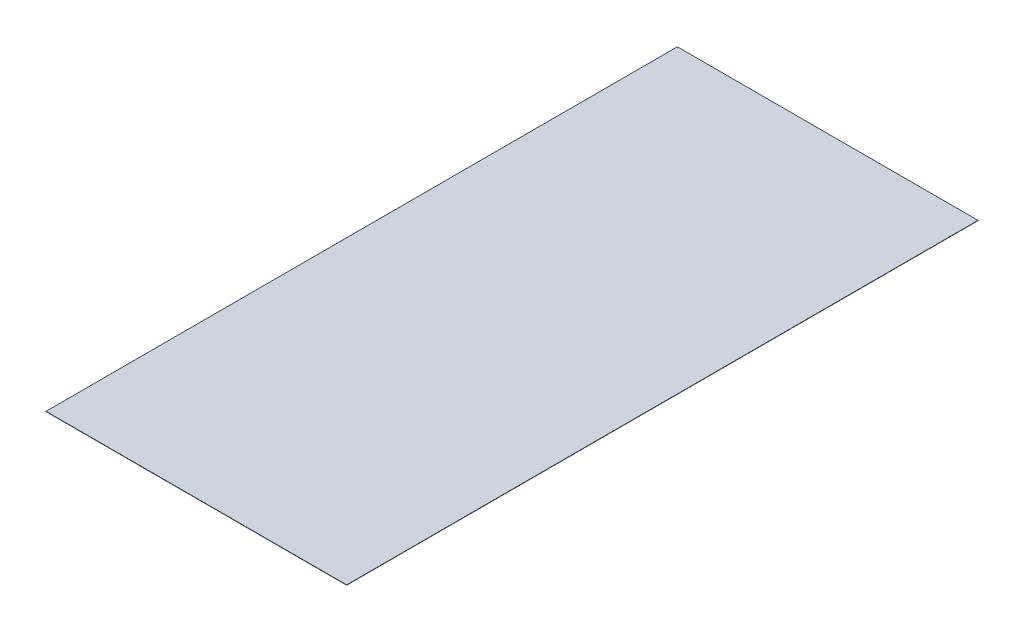
from build123d import *

# Parameters (mm, degrees)
SKETCH_1_W      = 1000
SKETCH_1_H      = 2100
EXTRUDE_1_DEPTH = 1


with BuildPart() as part:
    # Эскиз1 → Бобышка-Вытянуть1 (new body)
    with BuildSketch(Plane(origin=(0, 0, 0), x_dir=(1, 0, 0), z_dir=(0, 1, 0))):
        Rectangle(SKETCH_1_W, SKETCH_1_H)
    extrude(amount=EXTRUDE_1_DEPTH)


solid = part.part
